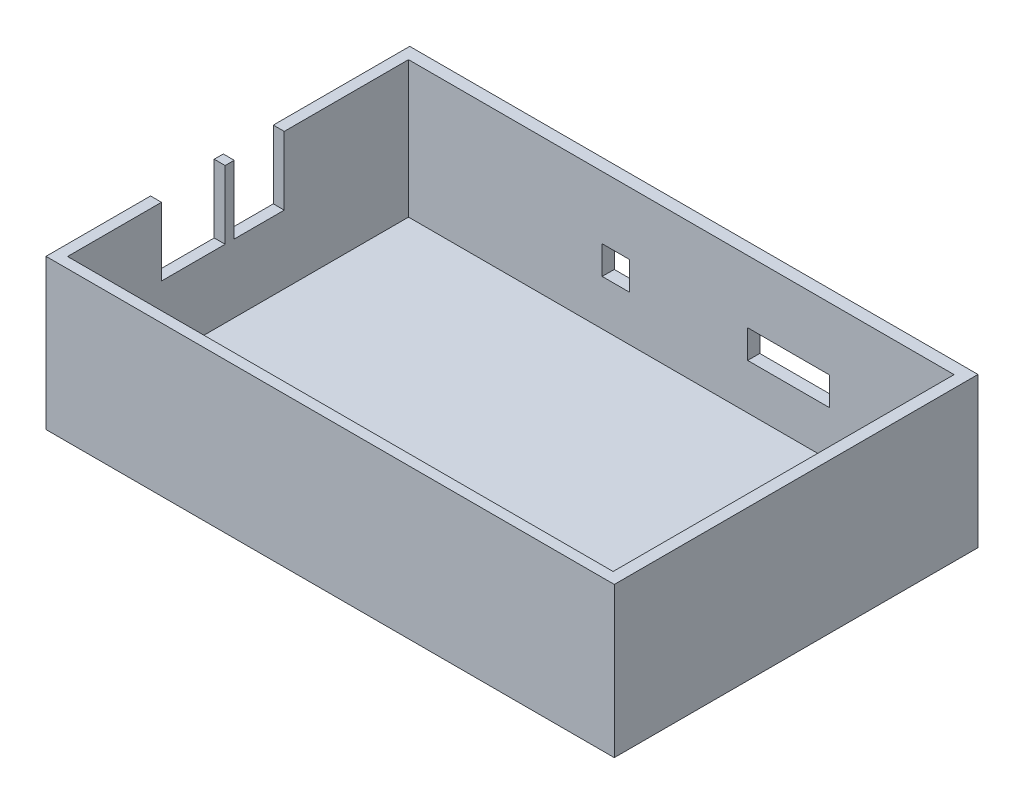
from build123d import *

# Parameters (mm, degrees)
SKETCH1_W           = 125
SKETCH1_H           = 80
BOSS_EXTRUDE1_DEPTH = 33
SKETCH3_W           = 120
SKETCH3_H           = 75
CUT_EXTRUDE1_DEPTH  = 30
SKETCH6_W           = 14.123986893
SKETCH6_H           = 14
SKETCH6_W_2         = 13.154693674
SKETCH6_H_2         = 11
CUT_EXTRUDE4_DEPTH  = 15
SKETCH7_W           = 6
SKETCH7_H           = 6.231170688
SKETCH7_W_2         = 18
CUT_EXTRUDE5_DEPTH  = 15


with BuildPart() as part:
    # Sketch1 → Boss-Extrude1 (new body)
    with BuildSketch(Plane(origin=(0, 0, 0), x_dir=(1, 0, 0), z_dir=(0, 1, 0))):
        with Locations((62.5, 40)):
            Rectangle(SKETCH1_W, SKETCH1_H)
    extrude(amount=BOSS_EXTRUDE1_DEPTH)

    # Sketch3 → Cut-Extrude1 (cut)
    with BuildSketch(Plane(origin=(0, 33, 0), x_dir=(1, 0, 0), z_dir=(0, 1, 0))):
        with Locations((62.403820475, 39.836034952)):
            Rectangle(SKETCH3_W, SKETCH3_H)
    extrude(amount=-CUT_EXTRUDE1_DEPTH, mode=Mode.SUBTRACT)

    # Sketch6 → Cut-Extrude4 (cut)
    with BuildSketch(Plane(origin=(0, 33, 0), x_dir=(1, 0, 0), z_dir=(0, 1, 0))):
        with Locations((0.880645417, 30)):
            Rectangle(SKETCH6_W, SKETCH6_H)
        with Locations((1.365292027, 44.5)):
            Rectangle(SKETCH6_W_2, SKETCH6_H_2)
    extrude(amount=-CUT_EXTRUDE4_DEPTH, mode=Mode.SUBTRACT)

    # Sketch7 → Cut-Extrude5 (cut)
    with BuildSketch(Plane(origin=(0, 0, -80), x_dir=(-1, 0, 0), z_dir=(0, 0, -1))):
        with Locations((-48, 16.115585344)):
            Rectangle(SKETCH7_W, SKETCH7_H)
        with Locations((-86, 16.115585344)):
            Rectangle(SKETCH7_W_2, SKETCH7_H)
    extrude(amount=-CUT_EXTRUDE5_DEPTH, mode=Mode.SUBTRACT)


solid = part.part
